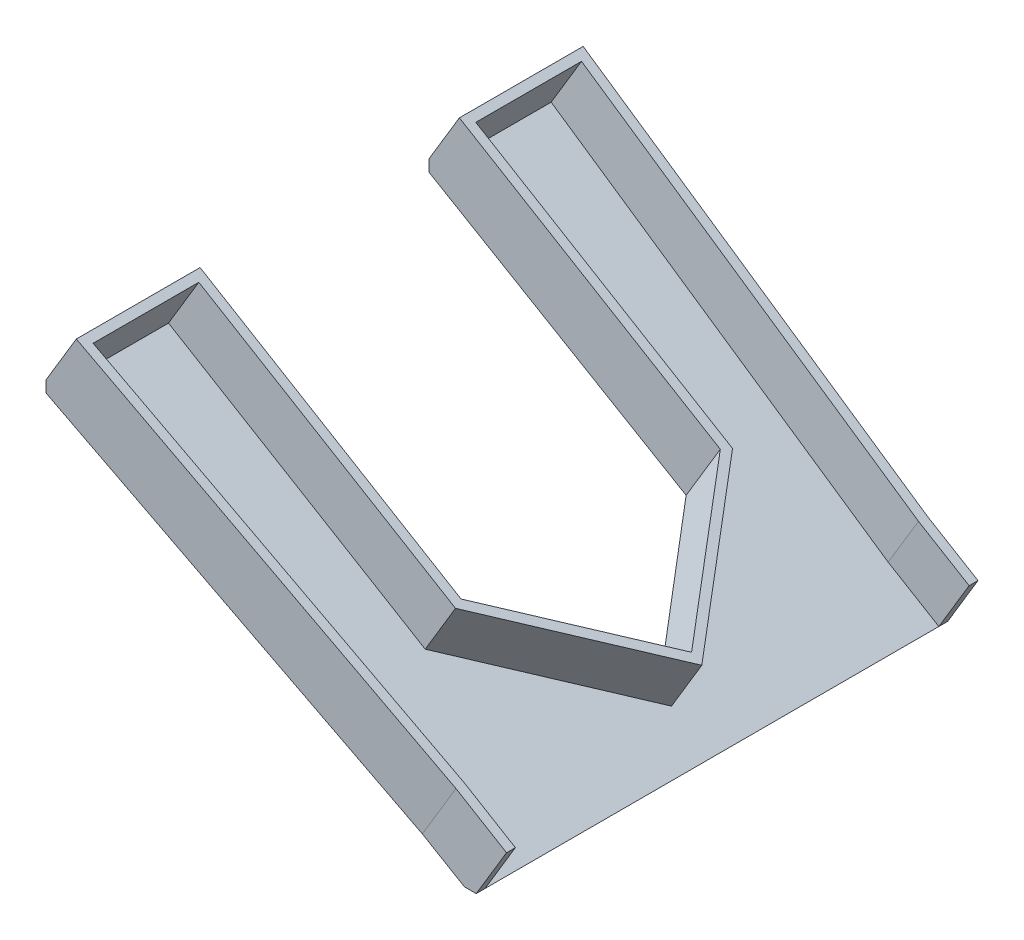
from build123d import *

# Parameters (mm, degrees)
EXTRUDE_1_DEPTH     = 86
CUT_EXTRUDE_1_DEPTH = 3
EXTRUDE_2_DEPTH     = 10


with BuildPart() as part:
    # Эскиз1 → Бобышка-Вытянуть1 (new body)
    with BuildSketch(Plane.XY):
        Polygon((35, -4), (33, -4), (-35, 36), (-35, 38), align=None)
    extrude(amount=EXTRUDE_1_DEPTH)

    # Эскиз2 → Вырез-Вытянуть1 (cut)
    with BuildSketch(Plane(origin=(7.5, 12.5, 0), x_dir=(0.8574929257125444, -0.5144957554275262, 0), z_dir=(0.5144957554275262, 0.8574929257125444, 0))):
        Polygon((22.070235422, -3), (32.070235422, -3), (32.070235422, 0), (-49.563091106, 0), align=None)
        Polygon((-49.563091106, -21), (-49.563091106, -43), (22.038839221, -43), (2.070235422, -21), align=None)
        Polygon((-49.563091106, -43), (-49.563091106, -65), (2.070235422, -65), (22.038839221, -43), align=None)
        Polygon((22.070235422, -83), (-49.563091106, -86), (32.070235422, -86), (32.070235422, -83), align=None)
    extrude(amount=-CUT_EXTRUDE_1_DEPTH, mode=Mode.SUBTRACT)

    # Эскиз3 → Бобышка-Вытянуть2 (add)
    with BuildSketch(Plane(origin=(7.5, 12.5, 0), x_dir=(0.8574929257125444, -0.5144957554275262, 0), z_dir=(0.5144957554275262, 0.8574929257125444, 0))):
        Polygon((-49.563091106, -65), (-49.563091106, -86), (22.070235422, -83), (32.070235422, -83), (32.070235422, -81.5), (22.038839221, -81.5), (-48.063091106, -84.435865207), (-48.063091106, -66.5), (2.734491563, -66.5), (24.064591076, -43), (2.734491563, -19.5), (-48.063091106, -19.5), (-48.063091106, -1.564134793), (22.038839221, -4.5), (32.070235422, -4.5), (32.070235422, -3), (22.070235422, -3), (-49.563091106, 0), (-49.563091106, -21), (2.070235422, -21), (22.038839221, -43), (2.070235422, -65), align=None)
    extrude(amount=EXTRUDE_2_DEPTH)


solid = part.part
